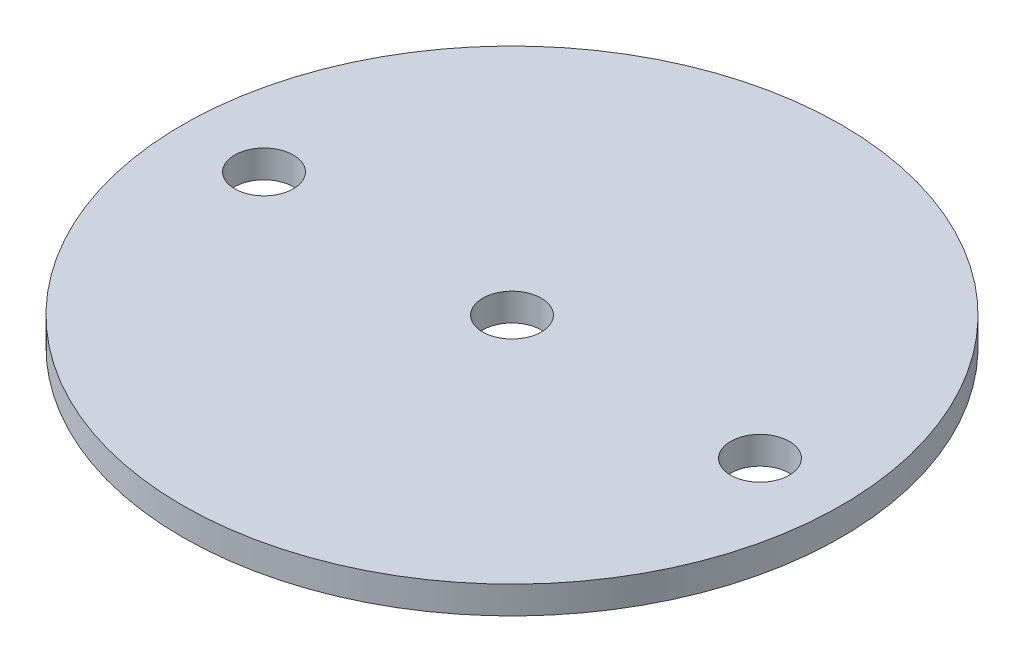
from build123d import *

# Parameters (mm, degrees)
SKETCH1_R                = 37.973
BOSS_EXTRUDE1_DEPTH      = 1.5875
H_0_266_DIAMETER_HOLE1_D = 6.7564
H_0_266_DIAMETER_HOLE2_D = 6.7564


with BuildPart() as part:
    # Sketch1 → Boss-Extrude1 (new, symmetric)
    with BuildSketch(Plane(origin=(0, 0, 0), x_dir=(1, 0, 0), z_dir=(0, 1, 0))):
        with Locations(Location((0, 0, 0), (0, 0, 270))):
            Circle(SKETCH1_R)
    extrude(amount=BOSS_EXTRUDE1_DEPTH, both=True)

    # H (0.266) Diameter Hole1 (through all)
    with Locations(Plane(origin=(0, 1.5875, 0), x_dir=(1, 0, 0), z_dir=(0, 1, 0))):
        with Locations((-28.575, 0), (28.575, 0)):
            Hole(H_0_266_DIAMETER_HOLE1_D / 2)

    # H (0.266) Diameter Hole2 (through all)
    with Locations(Plane(origin=(0, 1.5875, 0), x_dir=(1, 0, 0), z_dir=(0, 1, 0))):
        with Locations((0, 0)):
            Hole(H_0_266_DIAMETER_HOLE2_D / 2)


solid = part.part
